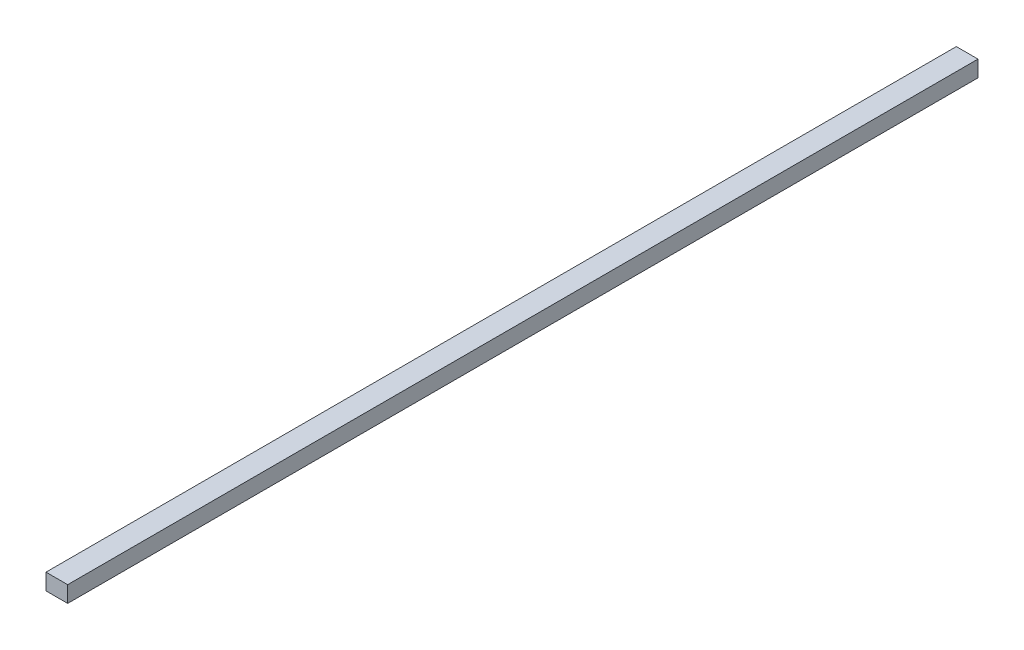
from build123d import *

# Parameters (mm, degrees)
SKETCH1_W           = 25.4
SKETCH1_H           = 1066.8
BOSS_EXTRUDE1_DEPTH = 19.05


with BuildPart() as part:
    # Sketch1 → Boss-Extrude1 (new body)
    with BuildSketch(Plane(origin=(0, 0, 0), x_dir=(1, 0, 0), z_dir=(0, 1, 0))):
        Rectangle(SKETCH1_W, SKETCH1_H)
    extrude(amount=BOSS_EXTRUDE1_DEPTH)


solid = part.part
